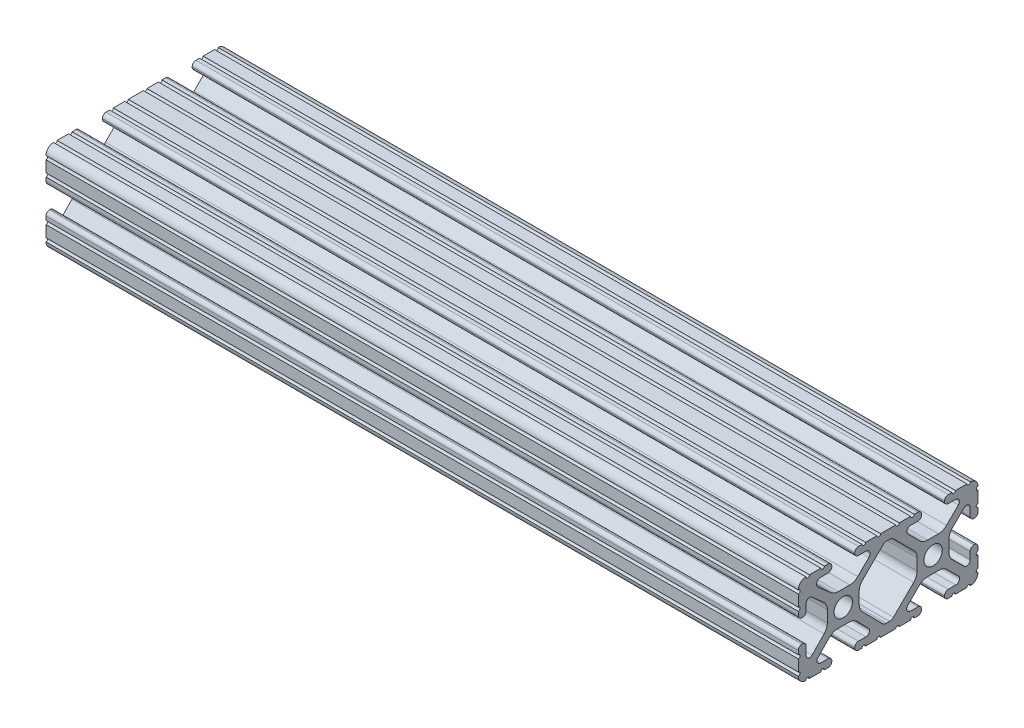
from build123d import *

# Parameters (mm, degrees)
SKETCH11_R                = 2.6035
F_10_1020_PROFILE_1_DEPTH = 212.725


with BuildPart() as part:
    # Sketch11 → 10 1020 PROFILE(1) (new body)
    with BuildSketch(Plane(origin=(0, 0, 0), x_dir=(0, 0, 1), z_dir=(1, 0, 0))):
        with BuildLine():
            Line((15.9385, 11.65104985), (15.9385, 11.53922))
            ThreePointArc((15.9385, 11.53922), (16.245750844, 10.797450844), (16.98752, 10.4902))
            Line((16.98752, 10.4902), (19.116384363, 10.4902))
            ThreePointArc((19.116384363, 10.4902), (20.052502933, 9.869096983), (19.844087081, 8.765172272))
            Line((19.844087081, 8.765172272), (16.618993479, 5.455112286))
            ThreePointArc((16.618993479, 5.455112286), (15.578994274, 4.745442459), (14.344932584, 4.4958))
            Line((14.344932584, 4.4958), (11.083317835, 4.4958))
            ThreePointArc((11.083317835, 4.4958), (9.854330953, 4.743306833), (8.816955189, 5.447238587))
            Line((8.816955189, 5.447238587), (5.564154119, 8.762652677))
            ThreePointArc((5.564154119, 8.762652677), (5.352591412, 9.867473037), (6.289393385, 10.4902))
            Line((6.289393385, 10.4902), (8.41248, 10.4902))
            ThreePointArc((8.41248, 10.4902), (9.154249156, 10.797450844), (9.4615, 11.53922))
            Line((9.4615, 11.53922), (9.4615, 11.65104985))
            ThreePointArc((9.4615, 11.65104985), (9.154269614, 12.392769614), (8.41254985, 12.7))
            Line((8.41254985, 12.7), (7.38288465, 12.7))
            ThreePointArc((7.38288465, 12.7), (6.87488465, 12.192), (6.36688465, 12.7))
            Line((6.36688465, 12.7), (3.14958095, 12.7))
            ThreePointArc((3.14958095, 12.7), (2.64158095, 12.192), (2.13358095, 12.7))
            Line((2.13358095, 12.7), (-2.13358095, 12.7))
            ThreePointArc((-2.13358095, 12.7), (-2.64158095, 12.192), (-3.14958095, 12.7))
            Line((-3.14958095, 12.7), (-6.36689735, 12.7))
            ThreePointArc((-6.36689735, 12.7), (-6.87489735, 12.192), (-7.38289735, 12.7))
            Line((-7.38289735, 12.7), (-8.41254985, 12.7))
            ThreePointArc((-8.41254985, 12.7), (-9.154269614, 12.392769614), (-9.4615, 11.65104985))
            Line((-9.4615, 11.65104985), (-9.4615, 11.53922))
            ThreePointArc((-9.4615, 11.53922), (-9.154249156, 10.797450844), (-8.41248, 10.4902))
            Line((-8.41248, 10.4902), (-6.283641037, 10.4902))
            ThreePointArc((-6.283641037, 10.4902), (-5.297291557, 9.829633109), (-5.532576693, 8.666071843))
            Line((-5.532576693, 8.666071843), (-8.809985098, 5.416263103))
            ThreePointArc((-8.809985098, 5.416263103), (-9.836720513, 4.734920264), (-11.045536121, 4.4958))
            Line((-11.045536121, 4.4958), (-14.354463879, 4.4958))
            ThreePointArc((-14.354463879, 4.4958), (-15.563279487, 4.734920264), (-16.590014902, 5.416263103))
            Line((-16.590014902, 5.416263103), (-19.867423307, 8.666071843))
            ThreePointArc((-19.867423307, 8.666071843), (-20.102708443, 9.829633109), (-19.116358963, 10.4902))
            Line((-19.116358963, 10.4902), (-16.98752, 10.4902))
            ThreePointArc((-16.98752, 10.4902), (-16.245750844, 10.797450844), (-15.9385, 11.53922))
            Line((-15.9385, 11.53922), (-15.9385, 11.65104985))
            ThreePointArc((-15.9385, 11.65104985), (-16.245730386, 12.392769614), (-16.98745015, 12.7))
            Line((-16.98745015, 12.7), (-18.01711535, 12.7))
            ThreePointArc((-18.01711535, 12.7), (-18.52511535, 12.192), (-19.03311535, 12.7))
            Line((-19.03311535, 12.7), (-22.2504, 12.7))
            ThreePointArc((-22.2504, 12.7), (-22.758323491, 12.192000006), (-23.266399977, 12.699846982))
            ThreePointArc((-23.266399977, 12.699846982), (-24.782522516, 12.082522516), (-25.399846982, 10.566399977))
            ThreePointArc((-25.399846982, 10.566399977), (-24.892000006, 10.058323491), (-25.4, 9.5504))
            Line((-25.4, 9.5504), (-25.4, 6.3330836))
            ThreePointArc((-25.4, 6.3330836), (-24.892, 5.8250836), (-25.4, 5.3170836))
            Line((-25.4, 5.3170836), (-25.4, 4.237520184))
            ThreePointArc((-25.4, 4.237520184), (-25.107393763, 3.531106237), (-24.400979816, 3.2385))
            Line((-24.400979816, 3.2385), (-24.23922, 3.2385))
            ThreePointArc((-24.23922, 3.2385), (-23.497450844, 3.545750844), (-23.1902, 4.28752))
            Line((-23.1902, 4.28752), (-23.1902, 6.334741132))
            ThreePointArc((-23.1902, 6.334741132), (-22.556026952, 7.286023527), (-21.434002553, 7.066535717))
            Line((-21.434002553, 7.066535717), (-18.147950853, 3.808156468))
            ThreePointArc((-18.147950853, 3.808156468), (-17.452759693, 2.774838327), (-17.208501877, 1.553619571))
            Line((-17.208501877, 1.553619571), (-17.208501877, -1.695179196))
            ThreePointArc((-17.208501877, -1.695179196), (-17.450738657, -2.911536421), (-18.140486065, -3.942289578))
            Line((-18.140486065, -3.942289578), (-21.431579576, -7.227386226))
            ThreePointArc((-21.431579576, -7.227386226), (-22.55444896, -7.449940594), (-23.1902, -6.498002195))
            Line((-23.1902, -6.498002195), (-23.1902, -4.28752))
            ThreePointArc((-23.1902, -4.28752), (-23.497450844, -3.545750844), (-24.23922, -3.2385))
            Line((-24.23922, -3.2385), (-24.35098, -3.2385))
            ThreePointArc((-24.35098, -3.2385), (-25.092749156, -3.545750844), (-25.4, -4.28752))
            Line((-25.4, -4.28752), (-25.4, -5.3171344))
            ThreePointArc((-25.4, -5.3171344), (-24.892, -5.8251344), (-25.4, -6.3331344))
            Line((-25.4, -6.3331344), (-25.4, -9.5504))
            ThreePointArc((-25.4, -9.5504), (-24.892000006, -10.058323491), (-25.399846982, -10.566399977))
            ThreePointArc((-25.399846982, -10.566399977), (-24.782522516, -12.082522516), (-23.266399977, -12.699846982))
            ThreePointArc((-23.266399977, -12.699846982), (-22.758323491, -12.192000006), (-22.2504, -12.7))
            Line((-22.2504, -12.7), (-19.03308995, -12.7))
            ThreePointArc((-19.03308995, -12.7), (-18.52508995, -12.192), (-18.01708995, -12.7))
            Line((-18.01708995, -12.7), (-16.9874692, -12.7))
            ThreePointArc((-16.9874692, -12.7), (-16.245700044, -12.392749156), (-15.9384492, -11.65098))
            Line((-15.9384492, -11.65098), (-15.9384492, -11.53922))
            ThreePointArc((-15.9384492, -11.53922), (-16.245700044, -10.797450844), (-16.9874692, -10.4902))
            Line((-16.9874692, -10.4902), (-19.116358963, -10.4902))
            ThreePointArc((-19.116358963, -10.4902), (-20.055197748, -9.862578342), (-19.834124023, -8.755124678))
            Line((-19.834124023, -8.755124678), (-16.49660751, -5.423689618))
            ThreePointArc((-16.49660751, -5.423689618), (-15.467274017, -4.736928798), (-14.253591699, -4.4958))
            Line((-14.253591699, -4.4958), (-11.146408301, -4.4958))
            ThreePointArc((-11.146408301, -4.4958), (-9.932725983, -4.736928798), (-8.90339249, -5.423689618))
            Line((-8.90339249, -5.423689618), (-5.565875977, -8.755124678))
            ThreePointArc((-5.565875977, -8.755124678), (-5.344802252, -9.862578342), (-6.283641037, -10.4902))
            Line((-6.283641037, -10.4902), (-8.4125308, -10.4902))
            ThreePointArc((-8.4125308, -10.4902), (-9.154299956, -10.797450844), (-9.4615508, -11.53922))
            Line((-9.4615508, -11.53922), (-9.4615508, -11.65098))
            ThreePointArc((-9.4615508, -11.65098), (-9.154299956, -12.392749156), (-8.4125308, -12.7))
            Line((-8.4125308, -12.7), (-7.38287195, -12.7))
            ThreePointArc((-7.38287195, -12.7), (-6.87487195, -12.192), (-6.36687195, -12.7))
            Line((-6.36687195, -12.7), (-3.14960635, -12.7))
            ThreePointArc((-3.14960635, -12.7), (-2.64160635, -12.192), (-2.13360635, -12.7))
            Line((-2.13360635, -12.7), (2.13360635, -12.7))
            ThreePointArc((2.13360635, -12.7), (2.64159365, -12.1920127), (3.14958095, -12.7))
            Line((3.14958095, -12.7), (6.36691005, -12.7))
            ThreePointArc((6.36691005, -12.7), (6.87491005, -12.192), (7.38291005, -12.7))
            Line((7.38291005, -12.7), (8.4125308, -12.7))
            ThreePointArc((8.4125308, -12.7), (9.154299956, -12.392749156), (9.4615508, -11.65098))
            Line((9.4615508, -11.65098), (9.4615508, -11.53922))
            ThreePointArc((9.4615508, -11.53922), (9.154299956, -10.797450844), (8.4125308, -10.4902))
            Line((8.4125308, -10.4902), (6.289393385, -10.4902))
            ThreePointArc((6.289393385, -10.4902), (5.231590322, -9.783049717), (5.480677245, -8.535265862))
            Line((5.480677245, -8.535265862), (8.597933595, -5.423689618))
            ThreePointArc((8.597933595, -5.423689618), (9.627267088, -4.736928798), (10.840949406, -4.4958))
            Line((10.840949406, -4.4958), (14.102564155, -4.4958))
            ThreePointArc((14.102564155, -4.4958), (15.215927525, -4.697410182), (16.187895372, -5.276636531))
            Line((16.187895372, -5.276636531), (19.868247549, -8.482246082))
            ThreePointArc((19.868247549, -8.482246082), (20.188435806, -9.746879864), (19.116384363, -10.4902))
            Line((19.116384363, -10.4902), (16.9874692, -10.4902))
            ThreePointArc((16.9874692, -10.4902), (16.245700044, -10.797450844), (15.9384492, -11.53922))
            Line((15.9384492, -11.53922), (15.9384492, -11.65098))
            ThreePointArc((15.9384492, -11.65098), (16.245700044, -12.392749156), (16.9874692, -12.7))
            Line((16.9874692, -12.7), (18.01710265, -12.7))
            ThreePointArc((18.01710265, -12.7), (18.52510265, -12.192), (19.03310265, -12.7))
            Line((19.03310265, -12.7), (22.2504, -12.7))
            ThreePointArc((22.2504, -12.7), (22.758323491, -12.192000006), (23.266399977, -12.699846982))
            ThreePointArc((23.266399977, -12.699846982), (24.782522516, -12.082522516), (25.399846982, -10.566399977))
            ThreePointArc((25.399846982, -10.566399977), (24.892000006, -10.058323492), (25.4, -9.550400001))
            Line((25.4, -9.550400001), (25.4, -6.333083592))
            ThreePointArc((25.4, -6.333083592), (24.892000001, -5.825083593), (25.4, -5.317083593))
            Line((25.4, -5.317083593), (25.4, -4.237520184))
            ThreePointArc((25.4, -4.237520184), (25.107393763, -3.531106237), (24.400979816, -3.2385))
            Line((24.400979816, -3.2385), (24.189220184, -3.2385))
            ThreePointArc((24.189220184, -3.2385), (23.482806237, -3.531106237), (23.1902, -4.237520184))
            Line((23.1902, -4.237520184), (23.1902, -6.155876159))
            ThreePointArc((23.1902, -6.155876159), (22.62232736, -7.038258539), (21.583974541, -6.886926384))
            Line((21.583974541, -6.886926384), (18.29817066, -4.024970844))
            ThreePointArc((18.29817066, -4.024970844), (17.493730985, -2.946044689), (17.208501877, -1.630807374))
            Line((17.208501877, -1.630807374), (17.208501877, 1.630807374))
            ThreePointArc((17.208501877, 1.630807374), (17.442348332, 2.82673414), (18.109440981, 3.846495088))
            Line((18.109440981, 3.846495088), (21.526346532, 7.353420386))
            ThreePointArc((21.526346532, 7.353420386), (22.585896263, 7.574939077), (23.1902, 6.676867167))
            Line((23.1902, 6.676867167), (23.1902, 4.237520184))
            ThreePointArc((23.1902, 4.237520184), (23.482806237, 3.531106237), (24.189220184, 3.2385))
            Line((24.189220184, 3.2385), (24.400979816, 3.2385))
            ThreePointArc((24.400979816, 3.2385), (25.107393763, 3.531106237), (25.4, 4.237520184))
            Line((25.4, 4.237520184), (25.4, 5.3170836))
            ThreePointArc((25.4, 5.3170836), (24.891949193, 5.825134407), (25.4, 6.333185215))
            Line((25.4, 6.333185215), (25.4, 9.550400015))
            ThreePointArc((25.4, 9.550400015), (24.892000013, 10.058323498), (25.399846982, 10.566399977))
            ThreePointArc((25.399846982, 10.566399977), (24.782522516, 12.082522516), (23.266399977, 12.699846982))
            ThreePointArc((23.266399977, 12.699846982), (22.758323491, 12.192000006), (22.2504, 12.7))
            Line((22.2504, 12.7), (19.03310265, 12.7))
            ThreePointArc((19.03310265, 12.7), (18.52510265, 12.192), (18.01710265, 12.7))
            Line((18.01710265, 12.7), (16.98745015, 12.7))
            ThreePointArc((16.98745015, 12.7), (16.245730386, 12.392769614), (15.9385, 11.65104985))
        make_face()
        with Locations((-12.7, 0)):
            Circle(SKETCH11_R, mode=Mode.SUBTRACT)
        with Locations((12.7, 0)):
            Circle(SKETCH11_R, mode=Mode.SUBTRACT)
        with BuildLine():
            Line((-8.191498123, 1.622302656), (-8.191498123, -1.622302656))
            ThreePointArc((-8.191498123, -1.622302656), (-7.949261343, -2.838659881), (-7.259513935, -3.869413038))
            Line((-7.259513935, -3.869413038), (-1.545748891, -9.572766749))
            ThreePointArc((-1.545748891, -9.572766749), (-1.035199478, -9.913400116), (-0.433213048, -10.033))
            Line((-0.433213048, -10.033), (0.433213048, -10.033))
            ThreePointArc((0.433213048, -10.033), (1.035199478, -9.913400116), (1.545748891, -9.572766749))
            Line((1.545748891, -9.572766749), (7.259513935, -3.869413038))
            ThreePointArc((7.259513935, -3.869413038), (7.949261343, -2.838659881), (8.191498123, -1.622302656))
            Line((8.191498123, -1.622302656), (8.191498123, 1.622302656))
            ThreePointArc((8.191498123, 1.622302656), (7.955573352, 2.823327967), (7.282860769, 3.845864069))
            Line((7.282860769, 3.845864069), (1.675572808, 9.561086461))
            ThreePointArc((1.675572808, 9.561086461), (1.161034429, 9.910236611), (0.551456936, 10.033))
            Line((0.551456936, 10.033), (-0.395199982, 10.033))
            ThreePointArc((-0.395199982, 10.033), (-0.994772524, 9.914396349), (-1.50403329, 9.576450301))
            Line((-1.50403329, 9.576450301), (-7.252049147, 3.876839553))
            ThreePointArc((-7.252049147, 3.876839553), (-7.947240307, 2.843521412), (-8.191498123, 1.622302656))
        make_face(mode=Mode.SUBTRACT)
    extrude(amount=F_10_1020_PROFILE_1_DEPTH)


solid = part.part
